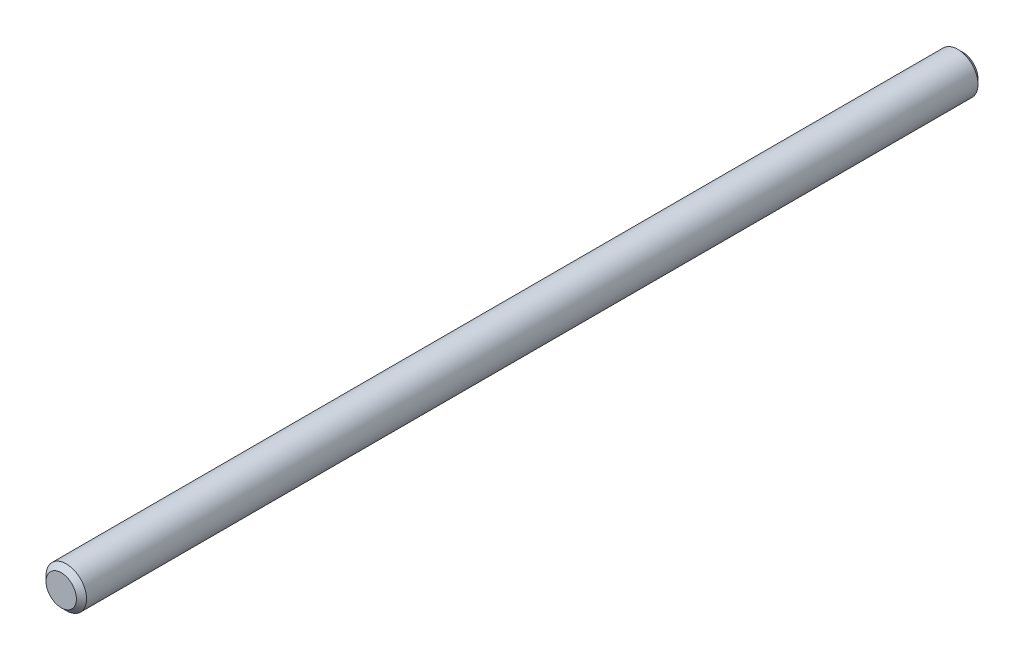
from build123d import *

# Parameters (mm, degrees)
SKETCH1_R           = 2
BOSS_EXTRUDE1_DEPTH = 44.45
CHAMFER1_SIZE       = 0.5


with BuildPart() as part:
    # Sketch1 → Boss-Extrude1 (new, symmetric)
    with BuildSketch(Plane.XY):
        Circle(SKETCH1_R)
    extrude(amount=BOSS_EXTRUDE1_DEPTH, both=True)

    # Chamfer1
    chamfer1_edges = [part.edges().sort_by_distance(p)[0] for p in [
        (-2, 0, -44.45),
        (-2, 0, 44.45),
    ]]
    chamfer(chamfer1_edges, length=CHAMFER1_SIZE)


solid = part.part
